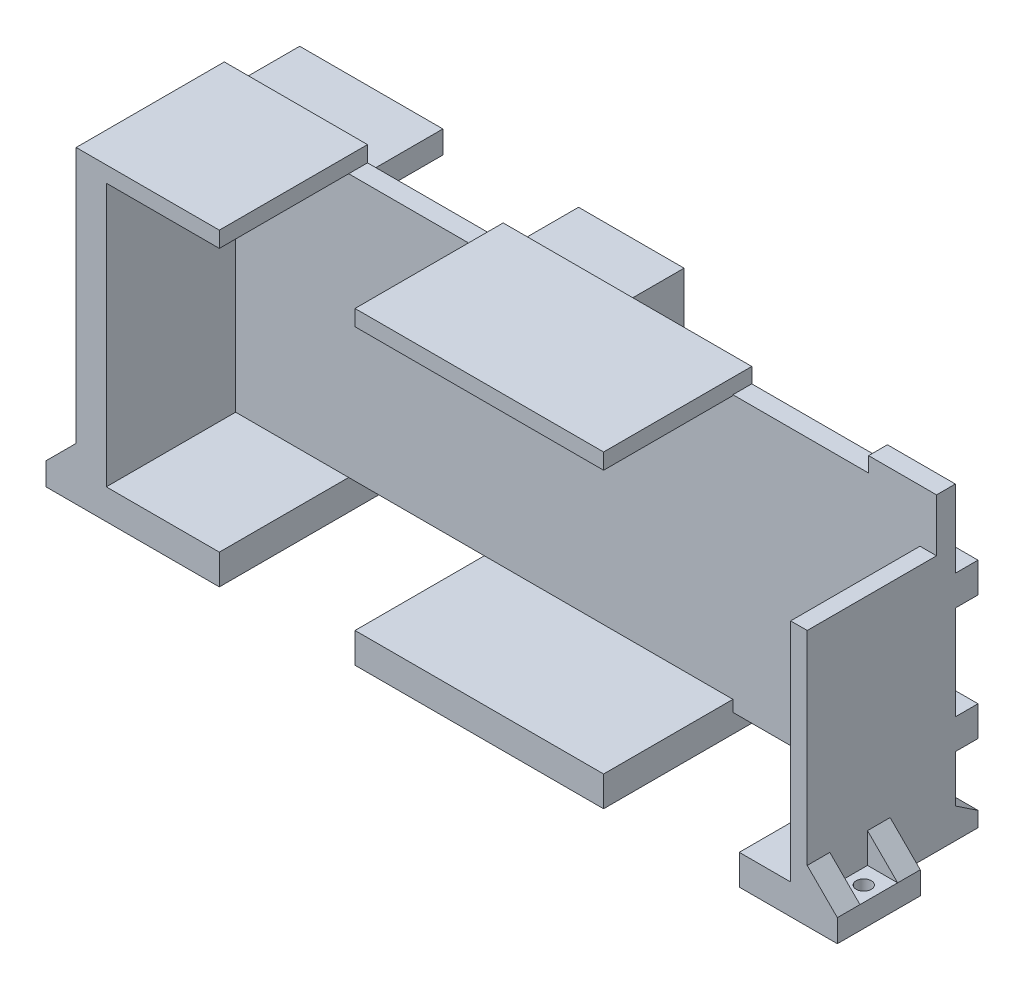
from build123d import *

# Parameters (mm, degrees)
SKETCH1_W            = 64.77
SKETCH1_H            = 48.006
SKETCH1_W_2          = 58.674
SKETCH1_H_2          = 40.386
BOSS_EXTRUDE1_DEPTH  = 12.7
BOSS_EXTRUDE2_DEPTH  = 3.175
BOSS_EXTRUDE3_DEPTH  = 21.7932
SKETCH6_W            = 22.86
SKETCH6_H            = 2.667
SKETCH6_H_2          = 5.08
CUT_EXTRUDE1_DEPTH   = 103.235990753
SKETCH7_W            = 22.86
SKETCH7_H            = 3.81
SKETCH7_H_2          = 1.143
CUT_EXTRUDE2_DEPTH   = 12.7
SKETCH10_W           = 13.97
SKETCH10_H           = 3.81
BOSS_EXTRUDE4_DEPTH  = 5.08
BOSS_EXTRUDE5_DEPTH  = 3.81
SKETCH12_R           = 1.27
CUT_EXTRUDE3_DEPTH   = 110.514697261
BOSS_EXTRUDE7_DEPTH  = 3.81
SKETCH14_W           = 13.97
SKETCH14_H           = 3.81
BOSS_EXTRUDE8_DEPTH  = 5.08
SKETCH15_R           = 1.27
CUT_EXTRUDE4_DEPTH   = 114.762270179
BOSS_EXTRUDE9_DEPTH  = 3.81
BOSS_EXTRUDE10_DEPTH = 3.81
SKETCH21_W           = 58.42
SKETCH21_H           = 5.08
SKETCH21_W_2         = 24.109012503
SKETCH21_H_2         = 2.54
SKETCH21_W_3         = 11.450987497
BOSS_EXTRUDE13_DEPTH = 3.81
BOSS_EXTRUDE14_DEPTH = 24.109012503
BOSS_EXTRUDE15_DEPTH = 11.450987497


with BuildPart() as part:
    # Sketch1 → Boss-Extrude1 (new body)
    with BuildSketch(Plane.XY):
        Rectangle(SKETCH1_W, SKETCH1_H)
        Rectangle(SKETCH1_W_2, SKETCH1_H_2, mode=Mode.SUBTRACT)
    extrude(amount=BOSS_EXTRUDE1_DEPTH)

    # Sketch3 → Boss-Extrude2 (add)
    with BuildSketch(Plane.XY.offset(12.7)):
        Polygon((79.354012503, -24.003), (79.354012503, -20.828), (56.494012503, -20.828), (56.494012503, -24.003), (-32.385, -24.003), (-32.385, 28.067), (56.494012503, 28.067), (56.494012503, 25.527), (79.354012503, 25.527), (79.354012503, 28.067), (90.805, 28.067), (90.805, -24.003), align=None)
    extrude(amount=BOSS_EXTRUDE2_DEPTH)

    # Sketch5 → Boss-Extrude3 (add)
    with BuildSketch(Plane.XY.offset(15.875)):
        Polygon((56.494012503, 28.067), (-32.385, 28.067), (-32.385, -24.003), (56.494012503, -24.003), (56.494012503, -18.923), (-27.305, -18.923), (-27.305, 25.4), (56.494012503, 25.4), align=None)
        Polygon((88.011, -18.923), (79.354012503, -18.923), (79.354012503, -24.003), (90.805, -24.003), (90.805, 19.177), (88.011, 19.177), align=None)
    extrude(amount=BOSS_EXTRUDE3_DEPTH)

    # Sketch6 → Cut-Extrude1 (cut, through all)
    with BuildSketch(Plane.XY.offset(37.6682)):
        with Locations((3.175, 26.7335)):
            Rectangle(SKETCH6_W, SKETCH6_H)
        with Locations((3.175, -21.463)):
            Rectangle(SKETCH6_W, SKETCH6_H_2)
    extrude(amount=-CUT_EXTRUDE1_DEPTH, mode=Mode.SUBTRACT)

    # Sketch7 → Cut-Extrude2 (cut)
    with BuildSketch(Plane(origin=(0, 0, 0), x_dir=(-1, 0, 0), z_dir=(0, 0, -1))):
        with Locations((-3.175, 22.098)):
            Rectangle(SKETCH7_W, SKETCH7_H)
        with Locations((-3.175, -20.7645)):
            Rectangle(SKETCH7_W, SKETCH7_H_2)
    extrude(amount=-CUT_EXTRUDE2_DEPTH, mode=Mode.SUBTRACT)

    # Sketch10 → Boss-Extrude4 (add)
    with BuildSketch(Plane.ZY.offset(32.385)):
        with Locations((30.6832, -22.098)):
            Rectangle(SKETCH10_W, SKETCH10_H)
    extrude(amount=BOSS_EXTRUDE4_DEPTH)

    # Sketch11 → Boss-Extrude5 (add)
    with BuildSketch(Plane.XY.offset(37.6682)):
        Polygon((-37.465, -20.193), (-32.385, -20.193), (-32.385, -15.113), align=None)
    extrude(amount=-BOSS_EXTRUDE5_DEPTH)

    # Sketch12 → Cut-Extrude3 (cut, through all)
    with BuildSketch(Plane(origin=(0, -20.193, 0), x_dir=(1, 0, 0), z_dir=(0, 1, 0))):
        with Locations(Location((-34.925, -30.6832, 0), (0, 0, 270))):
            Circle(SKETCH12_R)
    extrude(amount=-CUT_EXTRUDE3_DEPTH, mode=Mode.SUBTRACT)

    # Sketch13 → Boss-Extrude7 (add)
    with BuildSketch(Plane(origin=(0, 0, 23.6982), x_dir=(-1, 0, 0), z_dir=(0, 0, -1))):
        Polygon((32.385, -15.113), (32.385, -20.193), (37.465, -20.193), align=None)
    extrude(amount=-BOSS_EXTRUDE7_DEPTH)

    # Sketch14 → Boss-Extrude8 (add)
    with BuildSketch(Plane(origin=(90.805, 0, 0), x_dir=(0, 0, -1), z_dir=(1, 0, 0))):
        with Locations((-30.6832, -22.098)):
            Rectangle(SKETCH14_W, SKETCH14_H)
    extrude(amount=BOSS_EXTRUDE8_DEPTH)

    # Sketch15 → Cut-Extrude4 (cut, through all)
    with BuildSketch(Plane(origin=(0, -20.193, 0), x_dir=(1, 0, 0), z_dir=(0, 1, 0))):
        with Locations(Location((93.345, -30.6832, 0), (0, 0, 270))):
            Circle(SKETCH15_R)
    extrude(amount=-CUT_EXTRUDE4_DEPTH, mode=Mode.SUBTRACT)

    # Sketch17 → Boss-Extrude9 (add)
    with BuildSketch(Plane.XY.offset(37.6682)):
        Polygon((95.885, -20.193), (90.805, -20.193), (90.805, -15.113), align=None)
    extrude(amount=-BOSS_EXTRUDE9_DEPTH)

    # Sketch18 → Boss-Extrude10 (add)
    with BuildSketch(Plane(origin=(0, 0, 23.6982), x_dir=(-1, 0, 0), z_dir=(0, 0, -1))):
        Polygon((-95.885, -20.193), (-90.805, -20.193), (-90.805, -15.113), align=None)
    extrude(amount=-BOSS_EXTRUDE10_DEPTH)

    # Sketch21 → Boss-Extrude13 (add)
    with BuildSketch(Plane(origin=(0, 0, 12.7), x_dir=(-1, 0, 0), z_dir=(0, 0, -1))):
        with Locations((-61.595, 12.5095)):
            Rectangle(SKETCH21_W, SKETCH21_H)
        with Locations((-61.595, -8.4455)):
            Rectangle(SKETCH21_W, SKETCH21_H)
        with Locations((-44.439506252, -22.733)):
            Rectangle(SKETCH21_W_2, SKETCH21_H_2)
        with Locations((-85.079506252, -22.733)):
            Rectangle(SKETCH21_W_3, SKETCH21_H_2)
    extrude(amount=BOSS_EXTRUDE13_DEPTH)

    # Sketch22 → Boss-Extrude14 (add)
    with BuildSketch(Plane(origin=(56.494012503, 0, 0), x_dir=(0, 0, -1), z_dir=(1, 0, 0))):
        Polygon((-8.89, -21.463), (-12.7, -21.463), (-12.7, -18.923), align=None)
    extrude(amount=-BOSS_EXTRUDE14_DEPTH)

    # Sketch23 → Boss-Extrude15 (add)
    with BuildSketch(Plane(origin=(90.805, 0, 0), x_dir=(0, 0, -1), z_dir=(1, 0, 0))):
        Polygon((-8.89, -21.463), (-12.7, -21.463), (-12.7, -18.923), align=None)
    extrude(amount=-BOSS_EXTRUDE15_DEPTH)


solid = part.part
